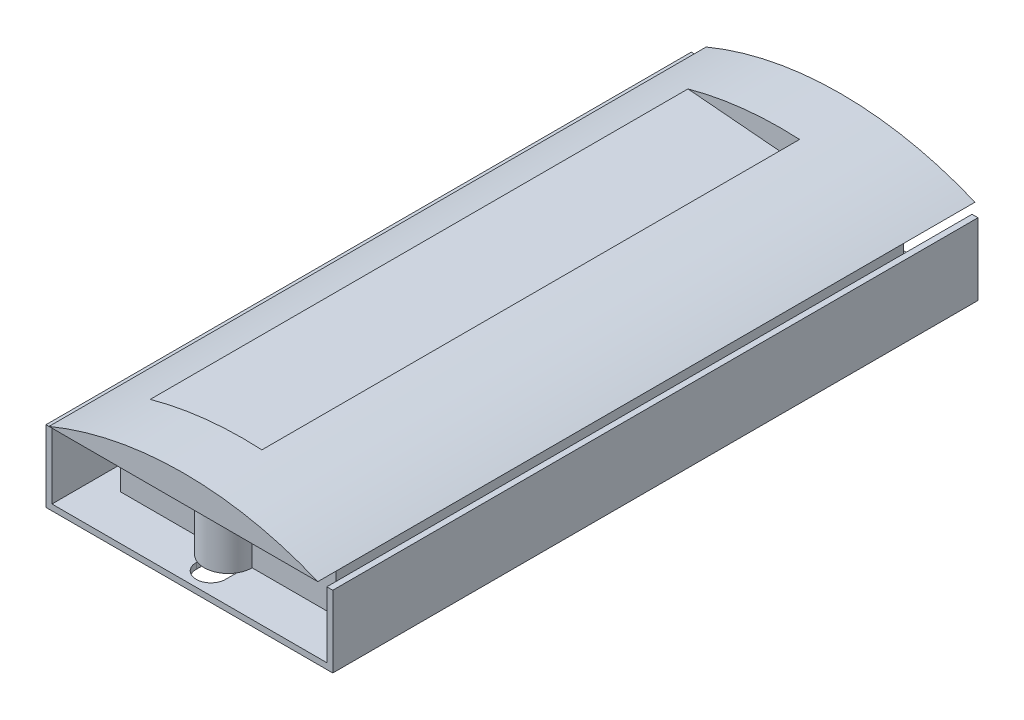
from build123d import *

# Parameters (mm, degrees)
EXTRUDE_1_DEPTH          = 110
SKETCH_2_W               = 14
SKETCH_2_H               = 95
SKETCH_2_W_2             = 8
EXTRUDE_2_DEPTH          = 11
SKETCH_3_R               = 1.6
CUT_EXTRUDE_1_DEPTH      = 11
SKETCH_4_W               = 48
SKETCH_4_H               = 108
EXTRUDE_3_DEPTH          = 1
SKETCH_5_W               = 1
SKETCH_5_H               = 12
EXTRUDE_4_DEPTH          = 108
CUT_EXTRUDE_2_DEPTH      = 45
CUT_EXTRUDE_2_DEPTH_BACK = 45


with BuildPart() as part:
    # 草图1 → 凸台-拉伸1 (new body)
    with BuildSketch(Plane.XY):
        with BuildLine():
            Line((0, 0), (45, 0))
            ThreePointArc((45, 0), (22.5, 4.5), (0, 0))
        make_face()
    extrude(amount=EXTRUDE_1_DEPTH)

    # 草图2 → 凸台-拉伸2 (add)
    with BuildSketch(Plane(origin=(0, 0, 0), x_dir=(-1, 0, 0), z_dir=(0, -1, 0))):
        with Locations((-11.5, -55)):
            Rectangle(SKETCH_2_W, SKETCH_2_H)
        with Locations((-22.5, -55)):
            Rectangle(SKETCH_2_W_2, SKETCH_2_H)
        with BuildLine():
            ThreePointArc((-26.5, -102.5), (-22.5, -106.5), (-18.5, -102.5))
            Line((-18.5, -102.5), (-26.5, -102.5))
        make_face()
        with Locations((-33.5, -55)):
            Rectangle(SKETCH_2_W, SKETCH_2_H)
        with BuildLine():
            Line((-26.5, -7.5), (-18.5, -7.5))
            ThreePointArc((-18.5, -7.5), (-22.5, -3.5), (-26.5, -7.5))
        make_face()
    extrude(amount=EXTRUDE_2_DEPTH)

    # 草图3 → 切除-拉伸1 (cut)
    with BuildSketch(Plane.XZ.offset(11)):
        with Locations(Location((22.5, 102.5, 0), (0, 0, 270))):
            Circle(SKETCH_3_R)
        with Locations(Location((22.5, 7.5, 0), (0, 0, 270))):
            Circle(SKETCH_3_R)
    extrude(amount=-CUT_EXTRUDE_1_DEPTH, mode=Mode.SUBTRACT)

    # 草图6 → 切除-拉伸2 (cut, two sides: drawn at the far end of the back side and taken through both)
    with BuildSketch(Plane(origin=(0, 0, 55), x_dir=(-1, 0, 0), z_dir=(0, 0, -1)).offset(-CUT_EXTRUDE_2_DEPTH_BACK)):
        with BuildLine():
            Line((-25.6355376, 4.415908826), (-28.879652294, 3.114923831))
            ThreePointArc((-28.879652294, 3.114923831), (-29.764951758, 1.806057322), (-28.879652294, 0.497190812))
            Line((-28.879652294, 0.497190812), (-5.388413498, 2.531348361))
            Line((-5.388413498, 2.531348361), (-21.708969166, 7.754187451))
            Line((-21.708969166, 7.754187451), (-25.6355376, 4.415908826))
        make_face()
    extrude(amount=CUT_EXTRUDE_2_DEPTH + CUT_EXTRUDE_2_DEPTH_BACK, mode=Mode.SUBTRACT)


with BuildPart() as body_2:
    # 草图4 → 凸台-拉伸3 (new body)
    with BuildSketch(Plane(origin=(0, -12, 0), x_dir=(-1, 0, 0), z_dir=(0, -1, 0))):
        with Locations((-22.5, -55)):
            Rectangle(SKETCH_4_W, SKETCH_4_H)
        with BuildLine():
            Line((-20.05, -4.6), (-20.05, -10.4))
            ThreePointArc((-20.05, -10.4), (-22.5, -12.85), (-24.95, -10.4))
            Line((-24.95, -10.4), (-24.95, -4.6))
            ThreePointArc((-24.95, -4.6), (-22.5, -2.15), (-20.05, -4.6))
        make_face(mode=Mode.SUBTRACT)
        with BuildLine():
            Line((-20.05, -105.4), (-20.05, -99.6))
            ThreePointArc((-20.05, -99.6), (-22.5, -97.15), (-24.95, -99.6))
            Line((-24.95, -99.6), (-24.95, -105.4))
            ThreePointArc((-24.95, -105.4), (-22.5, -107.85), (-20.05, -105.4))
        make_face(mode=Mode.SUBTRACT)
    extrude(amount=EXTRUDE_3_DEPTH)

    # 草图5 → 凸台-拉伸4 (add)
    with BuildSketch(Plane.XY.offset(109)):
        with Locations((-1, -7)):
            Rectangle(SKETCH_5_W, SKETCH_5_H)
        with Locations((46, -7)):
            Rectangle(SKETCH_5_W, SKETCH_5_H)
    extrude(amount=-EXTRUDE_4_DEPTH)


solid = Compound([part.part, body_2.part])
